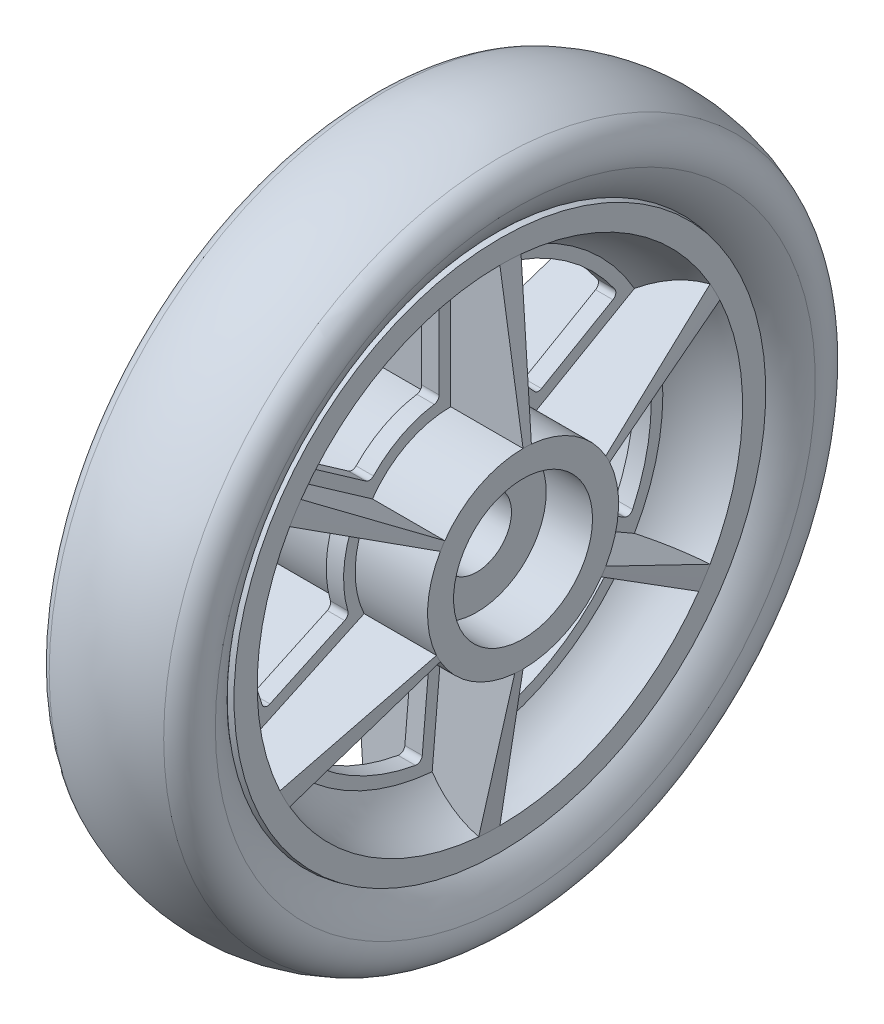
from build123d import *

# Parameters (mm, degrees)
REVOLU_O5_ANGLE              = 5
PADR_OCIRCULAR1_COUNT        = 6
CORTE_EXTRUS_O2_DEPTH        = 11.5
FILETE1_R                    = 1
PADR_OCIRCULAR2_COUNT        = 6
FILETE1_OF_PADR_OCIRCULAR2_R = 1


with BuildPart() as part:
    # Esboço1 → Revolução2 (revolve)
    with BuildSketch(Plane.XY, mode=Mode.PRIVATE) as revolu_o2_sk:
        with BuildLine():
            ThreePointArc((-9, 42.707614379), (-4.282717954, 40.549969439), (-0.50362409, 36.996572311))
            ThreePointArc((-0.50362409, 36.996572311), (0, 37), (0.50362409, 36.996572311))
            ThreePointArc((0.50362409, 36.996572311), (4.282717954, 40.549969439), (9, 42.707614379))
            Line((9, 42.707614379), (9, 46.130250379))
            ThreePointArc((9, 46.130250379), (9.500560524, 46.02976591), (10, 45.923850013))
            Line((10, 45.923850013), (10, 41.923850013))
            ThreePointArc((10, 41.923850013), (4.948041053, 39.791598743), (1, 35.986108431))
            ThreePointArc((1, 35.986108431), (0, 36), (-1, 35.986108431))
            ThreePointArc((-1, 35.986108431), (-4.948041053, 39.791598743), (-10, 41.923850013))
            Line((-10, 41.923850013), (-10, 45.923850013))
            ThreePointArc((-10, 45.923850013), (-9.500560524, 46.02976591), (-9, 46.130250379))
            Line((-9, 46.130250379), (-9, 42.707614379))
        make_face()
    revolve(revolu_o2_sk.sketch.rotate(Axis((0, 0, 0), (1, 0, 0)), 90), axis=Axis((0, 0, 0), (1, 0, 0)))



with BuildPart() as body_2:
    # Esboço2 → Revolução3 (revolve)
    with BuildSketch(Plane.XY, mode=Mode.PRIVATE) as revolu_o3_sk:
        with BuildLine():
            ThreePointArc((-12.663547147, 51.817622306), (0, 42.630143928), (12.663547147, 51.817622306))
            ThreePointArc((12.663547147, 51.817622306), (12.466953538, 55.427684257), (9.887958214, 57.961452096))
            ThreePointArc((9.887958214, 57.961452096), (0, 60), (-9.887958214, 57.961452096))
            ThreePointArc((-9.887958214, 57.961452096), (-12.466953538, 55.427684257), (-12.663547147, 51.817622306))
        make_face()
    revolve(revolu_o3_sk.sketch.rotate(Axis((0, 0, 0), (1, 0, 0)), 90), axis=Axis((0, 0, 0), (1, 0, 0)))


with BuildPart() as body_3:
    # Esboço5 → Revolução4 (revolve)
    with BuildSketch(Plane(origin=(0, 0, 0), x_dir=(1, 0, 0), z_dir=(0, 1, 0))):
        Polygon((-1.5, 40), (1.5, 40), (1.5, 16.5), (14, 16.5), (14, 12), (6, 12), (6, 6), (-6, 6), (-6, 12), (-14, 12), (-14, 16.5), (-1.5, 16.5), align=None)
    revolve(axis=Axis((0, 0, 0), (-1, 0, 0)))


with BuildPart() as part_1:
    add(part.part)

    add(body_3.part)  # Revolução5 merges body 3
    # Esboço7 → Revolução5 (revolve)
    with BuildSketch(Plane.XY):
        Polygon((14, 16.5), (-14, 16.5), (-10, 41.923850013), (10, 41.923850013), align=None)
    revolu_o5 = revolve(axis=Axis((0, 0, 0), (-1, 0, 0)), revolution_arc=REVOLU_O5_ANGLE)

    # PadrãoCircular1: Revolução5 ×6 about axis
    padr_ocircular1_axis = Axis((14, 0, 0), (1, 0, 0))
    for i in range(1, PADR_OCIRCULAR1_COUNT):
        add(revolu_o5.rotate(padr_ocircular1_axis, i * 360 / PADR_OCIRCULAR1_COUNT))

    # Esboço9 → Corte-extrusão2 (cut, symmetric)
    with BuildSketch(Plane.ZY.offset(1.5)):
        with BuildLine():
            Line((2, 18.391574158), (2, 34.589346547))
            ThreePointArc((2, 34.589346547), (15.998259414, 30.732370398), (27.186781062, 21.477938217))
            Line((27.186781062, 21.477938217), (13.918342696, 12.187277653))
            ThreePointArc((13.918342696, 12.187277653), (8.542349345, 16.409700414), (2, 18.391574158))
        make_face()
    corte_extrus_o2 = extrude(amount=CORTE_EXTRUS_O2_DEPTH, both=True, mode=Mode.SUBTRACT)

    # Filete1
    filete1_edges = [part_1.edges().sort_by_distance(p)[0] for p in [
        (0, 34.589346547, 2),
        (0, 21.477938217, 27.186781062),
        (0, 12.187277653, 13.918342696),
        (0, 18.391574158, 2),
    ]]
    fillet(filete1_edges, radius=FILETE1_R)

    # PadrãoCircular2: Corte-extrusão2 ×6 about axis
    padr_ocircular2_axis = Axis((0, 0, 0), (1, 0, 0))
    for i in range(1, PADR_OCIRCULAR2_COUNT):
        add(corte_extrus_o2.rotate(padr_ocircular2_axis, i * 360 / PADR_OCIRCULAR2_COUNT), mode=Mode.SUBTRACT)

    # Filete1 of PadrãoCircular2
    filete1_of_padr_ocircular2_edges = [part_1.edges().sort_by_distance(p)[0] for p in [
        (0, 15.562622466, 30.95525281),
        (0, -12.805473938, 32.193830647),
        (0, -5.959999527, 17.513663399),
        (0, 7.463736271, 16.927570436),
        (0, -19.026724081, 28.95525281),
        (0, -34.283412155, 5.007049586),
        (0, -18.14727718, 3.595320702),
        (0, -10.927837886, 14.927570436),
        (0, -34.589346547, -2),
        (0, -21.477938217, -27.186781062),
        (0, -12.187277653, -13.918342696),
        (0, -18.391574158, -2),
        (0, -15.562622466, -30.95525281),
        (0, 12.805473938, -32.193830647),
        (0, 5.959999527, -17.513663399),
        (0, -7.463736271, -16.927570436),
        (0, 19.026724081, -28.95525281),
        (0, 34.283412155, -5.007049586),
        (0, 18.14727718, -3.595320702),
        (0, 10.927837886, -14.927570436),
    ]]
    fillet(filete1_of_padr_ocircular2_edges, radius=FILETE1_OF_PADR_OCIRCULAR2_R)


solid = Compound([body_2.part, part_1.part])
